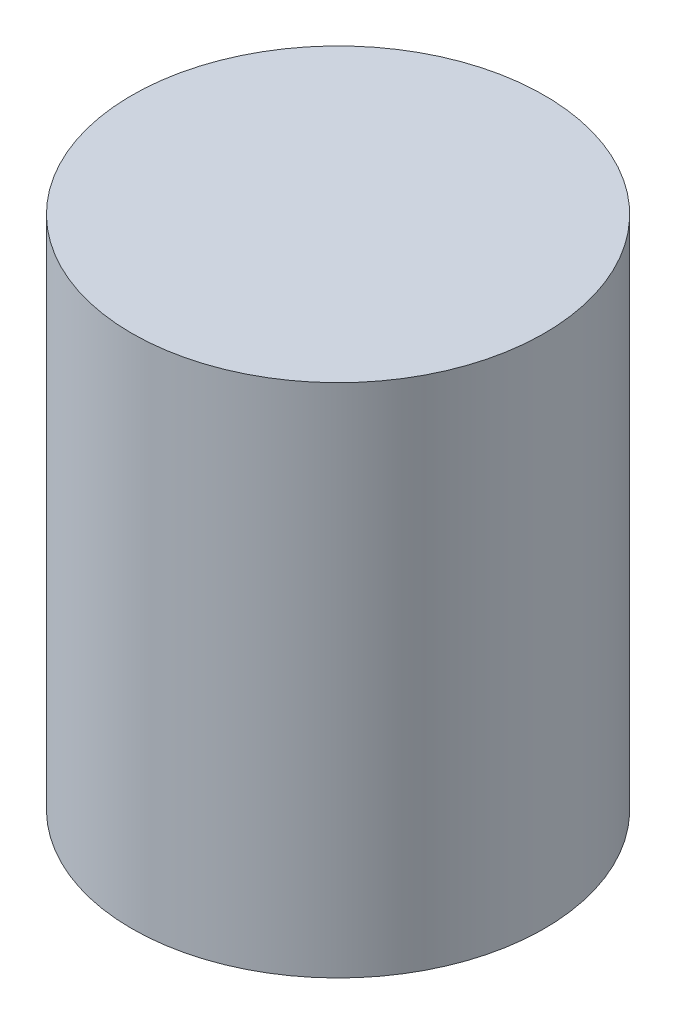
from build123d import *

# Parameters (mm, degrees)
SKETCH1_R           = 40
BOSS_EXTRUDE1_DEPTH = 100
SKETCH2_R           = 10
SKETCH2_R_2         = 5
CUT_EXTRUDE1_DEPTH  = 20


with BuildPart() as part:
    # Sketch1 → Boss-Extrude1 (new body)
    with BuildSketch(Plane(origin=(0, 0, 0), x_dir=(1, 0, 0), z_dir=(0, 1, 0))):
        with Locations(Location((0, 0, 0), (0, 0, 270))):
            Circle(SKETCH1_R)
    extrude(amount=BOSS_EXTRUDE1_DEPTH)

    # Sketch2 → Cut-Extrude1 (cut)
    with BuildSketch(Plane.XZ):
        with Locations(Location((0, 0, 0), (0, 0, 270))):
            Circle(SKETCH2_R)
        with Locations(Location((0, 22, 0), (0, 0, 270))):
            Circle(SKETCH2_R_2)
        with Locations(Location((0, -22, 0), (0, 0, 270))):
            Circle(SKETCH2_R_2)
    extrude(amount=-CUT_EXTRUDE1_DEPTH, mode=Mode.SUBTRACT)


solid = part.part
